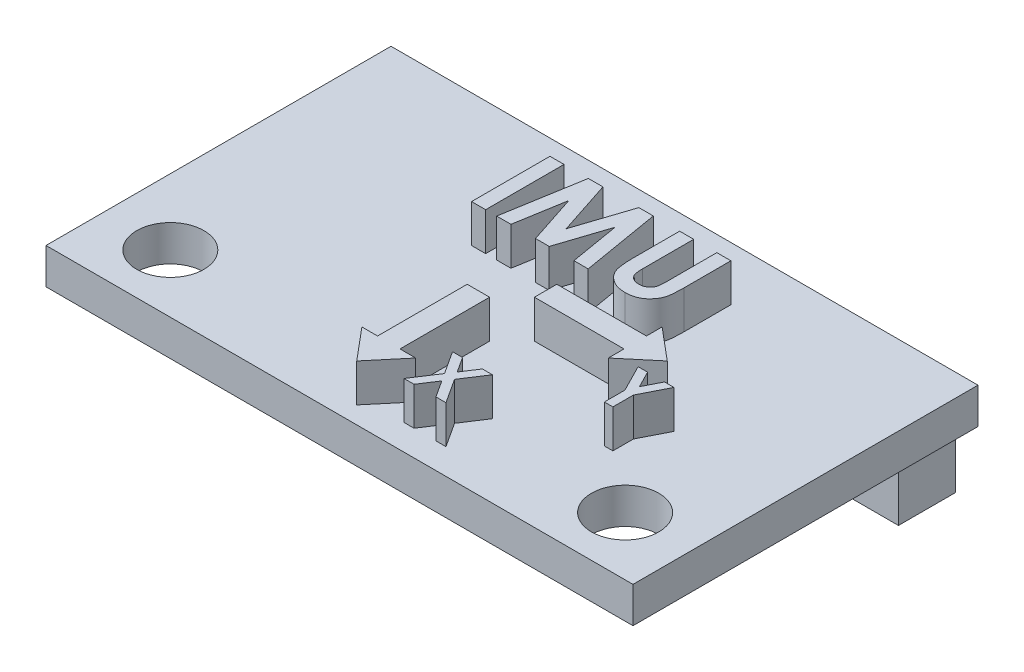
from build123d import *

# Parameters (mm, degrees)
SKETCH_1_W      = 26.2
SKETCH_1_H      = 15.4
SKETCH_1_R      = 1.5
EXTRUDE_1_DEPTH = 1.6
SKETCH_1_3_W    = 25
SKETCH_1_3_H    = 2.55
EXTRUDE_2_DEPTH = 2.65
SKETCH_2_W      = 0.628205128
SKETCH_2_H      = 3.5
EXTRUDE_3_DEPTH = 1.7


with BuildPart() as part:
    # 스케치1 → 보스-돌출1 (new body)
    with BuildSketch(Plane(origin=(0, 0, 0), x_dir=(1, 0, 0), z_dir=(0, 1, 0))):
        Rectangle(SKETCH_1_W, SKETCH_1_H)
        with Locations((-10.15, -5.1)):
            Circle(SKETCH_1_R, mode=Mode.SUBTRACT)
        with Locations((10.15, -5.1)):
            Circle(SKETCH_1_R, mode=Mode.SUBTRACT)
    extrude(amount=EXTRUDE_1_DEPTH)

    # 스케치1<3> → 보스-돌출2 (add)
    with BuildSketch(Plane(origin=(0, 0, 0), x_dir=(1, 0, 0), z_dir=(0, 1, 0))):
        with Locations((0, 6.025)):
            Rectangle(SKETCH_1_3_W, SKETCH_1_3_H)
    extrude(amount=-EXTRUDE_2_DEPTH)

    # 스케치2 → 보스-돌출3 (add)
    with BuildSketch(Plane(origin=(0, 1.6, 0), x_dir=(1, 0, 0), z_dir=(0, 1, 0))):
        Polygon((0.5, -1.5), (-0.5, -1.5), (-0.5, -5.5), (-1.2, -5.5), (0, -6.930104311), (1.2, -5.5), (0.5, -5.5), align=None)
        Polygon((5.5, -1.2), (6.930104311, 0), (5.5, 1.2), (5.5, 0.5), (1.5, 0.5), (1.5, -0.5), (5.5, -0.5), align=None)
        with Locations((-3.28532471, 3.544331345)):
            Rectangle(SKETCH_2_W, SKETCH_2_H)
        Polygon((-1.886586729, 5.294331345), (-1.23454346, 5.294331345), (-0.435965736, 2.853025255), (0.368220963, 5.294331345), (1.013954136, 5.294331345), (1.605700931, 1.794331345), (0.969783463, 1.794331345), (0.596085547, 4.004968364), (-0.131678877, 1.794331345), (-0.744459325, 1.794331345), (-1.468017018, 4.004968364), (-1.841013812, 1.794331345), (-2.477632402, 1.794331345), align=None)
        with BuildLine():
            Line((2.189034264, 5.294331345), (2.817239393, 5.294331345))
            Line((2.817239393, 5.294331345), (2.817239393, 3.017087755))
            add(Edge.make_bspline(
                [(2.817239393, 3.017087755), (2.817273551, 2.993478281), (2.817339529, 2.947876826), (2.82064238, 2.882453669), (2.823664717, 2.822316089), (2.82911787, 2.767529925), (2.837174047, 2.71807174), (2.844975055, 2.673623833), (2.855532948, 2.634981994), (2.871399773, 2.590997464), (2.895845342, 2.541578443), (2.935788046, 2.490072805), (2.981878508, 2.443066435), (3.037120582, 2.403940113), (3.099207788, 2.372290446), (3.167798984, 2.348841544), (3.242797481, 2.335807069), (3.294654828, 2.333817117), (3.321345963, 2.332792883)],
                knots=[0, 0, 0, 0, 1.155499968, 2.231836252, 3.205919964, 4.102923608, 4.924856345, 5.658536265, 6.31071849, 6.882491295, 7.94666036, 8.992281882, 10.060072772, 11.158554251, 12.289267114, 13.461410017, 14.693379945, 16, 16, 16, 16], degree=3))
            add(Edge.make_bspline(
                [(3.321345963, 2.332792883), (3.349702001, 2.333620333), (3.404991473, 2.33523372), (3.484516578, 2.351070858), (3.558197038, 2.376289005), (3.624472787, 2.412281729), (3.68327787, 2.455425316), (3.733055141, 2.504622525), (3.772339181, 2.55997148), (3.797943056, 2.611035105), (3.812318371, 2.658034726), (3.823093386, 2.700027104), (3.830992664, 2.749573953), (3.838159148, 2.805901493), (3.842465653, 2.869593167), (3.847135356, 2.940136761), (3.848846846, 3.018014951), (3.849138556, 3.072242996), (3.849290675, 3.100521249)],
                knots=[0, 0, 0, 0, 1.261321664, 2.459363699, 3.594844139, 4.716940403, 5.803436589, 6.833651888, 7.818396249, 8.814403945, 9.360733334, 10.004355033, 10.743453831, 11.592799886, 12.532235708, 13.585170094, 14.740740724, 16, 16, 16, 16], degree=3))
            Line((3.849290675, 3.100521249), (3.849290675, 5.294331345))
            Line((3.849290675, 5.294331345), (4.477495803, 5.294331345))
            Line((4.477495803, 5.294331345), (4.477495803, 3.20639064))
            add(Edge.make_bspline(
                [(4.477495803, 3.20639064), (4.477408565, 3.164089061), (4.477240816, 3.08274725), (4.474664688, 2.965853344), (4.469180577, 2.859089511), (4.464574557, 2.762424556), (4.455660331, 2.675988702), (4.446373798, 2.599412843), (4.434537313, 2.532968347), (4.416925335, 2.457329363), (4.386532275, 2.370233842), (4.337534678, 2.269947127), (4.275335399, 2.171760357), (4.201818961, 2.076753656), (4.118812177, 1.988495493), (4.028155486, 1.91101625), (3.931289197, 1.845477164), (3.827201127, 1.793480747), (3.71597986, 1.752927462), (3.596524945, 1.725677696), (3.46891784, 1.707267413), (3.380777201, 1.705498879), (3.335368399, 1.704587755)],
                knots=[0, 0, 0, 0, 1.170808336, 2.251350247, 3.235597562, 4.129743112, 4.929140599, 5.639994148, 6.264258765, 6.79612947, 7.788252245, 8.809469599, 9.879094798, 10.999557536, 12.129761673, 13.226370002, 14.293821979, 15.358369427, 16.438775801, 17.562147481, 18.744053101, 20, 20, 20, 20], degree=3))
            add(Edge.make_bspline(
                [(3.335368399, 1.704587755), (3.305197888, 1.705095937), (3.245672088, 1.706098571), (3.158128956, 1.714939179), (3.073501323, 1.727966912), (2.991948202, 1.746973032), (2.913186538, 1.771525389), (2.837237257, 1.801747631), (2.764382604, 1.837471182), (2.695030264, 1.878367463), (2.62926558, 1.92258975), (2.569160054, 1.971612016), (2.512645313, 2.021808881), (2.461354044, 2.075292841), (2.414901005, 2.131502406), (2.373381866, 2.190564964), (2.33685831, 2.252475271), (2.304411607, 2.318349254), (2.276640395, 2.391535053), (2.253228221, 2.474635914), (2.232774795, 2.568954362), (2.217575015, 2.67470289), (2.203794806, 2.791532964), (2.195072693, 2.919748944), (2.190509763, 3.059354507), (2.189538525, 3.156140151), (2.189034264, 3.20639064)],
                knots=[0, 0, 0, 0, 1.001158378, 1.975264943, 2.917723546, 3.841610987, 4.75185031, 5.653588123, 6.552117133, 7.442167995, 8.324307438, 9.179605724, 10.014504199, 10.831958861, 11.636465792, 12.43274043, 13.225645099, 14.020104002, 14.867201867, 15.819789774, 16.883317127, 18.068162734, 19.364263498, 20.787406516, 22.332041935, 24, 24, 24, 24], degree=3))
            Line((2.189034264, 3.20639064), (2.189034264, 5.294331345))
        make_face()
        Polygon((1.779131112, -4.434974289), (2.226887522, -4.434974289), (2.66913178, -5.114665128), (3.112224061, -4.434974289), (3.560404483, -4.434974289), (2.893009985, -5.458538659), (3.604501705, -6.551640956), (3.156745295, -6.551640956), (2.66913178, -5.801988178), (2.18024623, -6.551640956), (1.732065808, -6.551640956), (2.445253575, -5.458114647), align=None)
        Polygon((6.501577719, -0.872404796), (6.924317436, -0.872404796), (7.302111907, -1.614849374), (7.679906378, -0.872404796), (8.102646095, -0.872404796), (7.492069172, -2.072358055), (7.492069172, -2.989071463), (7.112154642, -2.989071463), (7.112154642, -2.072358055), align=None)
    extrude(amount=EXTRUDE_3_DEPTH)


solid = part.part
